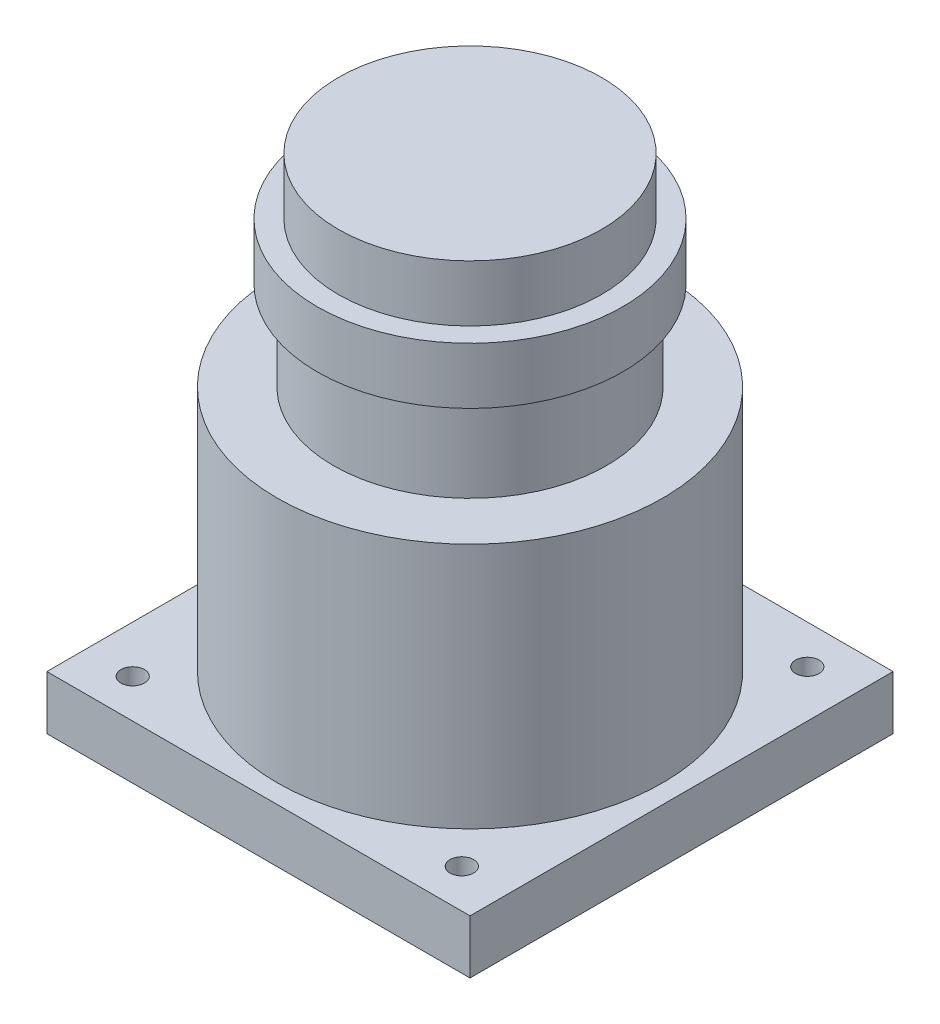
from build123d import *

# Parameters (mm, degrees)
SKETCH1_W           = 90
SKETCH1_H           = 90
BOSS_EXTRUDE1_DEPTH = 11.45
SKETCH2_R           = 41
BOSS_EXTRUDE2_DEPTH = 52.45
SKETCH3_R           = 29.05
BOSS_EXTRUDE3_DEPTH = 19
SKETCH4_R           = 32.5
BOSS_EXTRUDE4_DEPTH = 12
SKETCH5_R           = 28
BOSS_EXTRUDE5_DEPTH = 12
SKETCH6_R           = 2.5
CUT_EXTRUDE1_DEPTH  = 115.720105038


with BuildPart() as part:
    # Sketch1 → Boss-Extrude1 (new body)
    with BuildSketch(Plane(origin=(0, 0, 0), x_dir=(1, 0, 0), z_dir=(0, 1, 0))):
        Rectangle(SKETCH1_W, SKETCH1_H)
    extrude(amount=BOSS_EXTRUDE1_DEPTH)

    # Sketch2 → Boss-Extrude2 (add)
    with BuildSketch(Plane(origin=(0, 11.45, 0), x_dir=(1, 0, 0), z_dir=(0, 1, 0))):
        with Locations(Location((0, 0, 0), (0, 0, 270))):
            Circle(SKETCH2_R)
    extrude(amount=BOSS_EXTRUDE2_DEPTH)

    # Sketch3 → Boss-Extrude3 (add)
    with BuildSketch(Plane(origin=(0, 63.9, 0), x_dir=(1, 0, 0), z_dir=(0, 1, 0))):
        with Locations(Location((0, 0, 0), (0, 0, 270))):
            Circle(SKETCH3_R)
    extrude(amount=BOSS_EXTRUDE3_DEPTH)

    # Sketch4 → Boss-Extrude4 (add)
    with BuildSketch(Plane(origin=(0, 82.9, 0), x_dir=(1, 0, 0), z_dir=(0, 1, 0))):
        with Locations(Location((0, 0, 0), (0, 0, 270))):
            Circle(SKETCH4_R)
    extrude(amount=BOSS_EXTRUDE4_DEPTH)

    # Sketch5 → Boss-Extrude5 (add)
    with BuildSketch(Plane(origin=(0, 94.9, 0), x_dir=(1, 0, 0), z_dir=(0, 1, 0))):
        with Locations(Location((0, 0, 0), (0, 0, 270))):
            Circle(SKETCH5_R)
    extrude(amount=BOSS_EXTRUDE5_DEPTH)

    # Sketch6 → Cut-Extrude1 (cut, through all)
    with BuildSketch(Plane(origin=(0, 11.45, 0), x_dir=(1, 0, 0), z_dir=(0, 1, 0))):
        with Locations(Location((-35, 36.75, 0), (0, 0, 270))):
            Circle(SKETCH6_R)
        with Locations(Location((35, 36.75, 0), (0, 0, 270))):
            Circle(SKETCH6_R)
        with Locations(Location((35, -36.75, 0), (0, 0, 270))):
            Circle(SKETCH6_R)
        with Locations(Location((-35, -36.75, 0), (0, 0, 270))):
            Circle(SKETCH6_R)
    extrude(amount=-CUT_EXTRUDE1_DEPTH, mode=Mode.SUBTRACT)


solid = part.part
